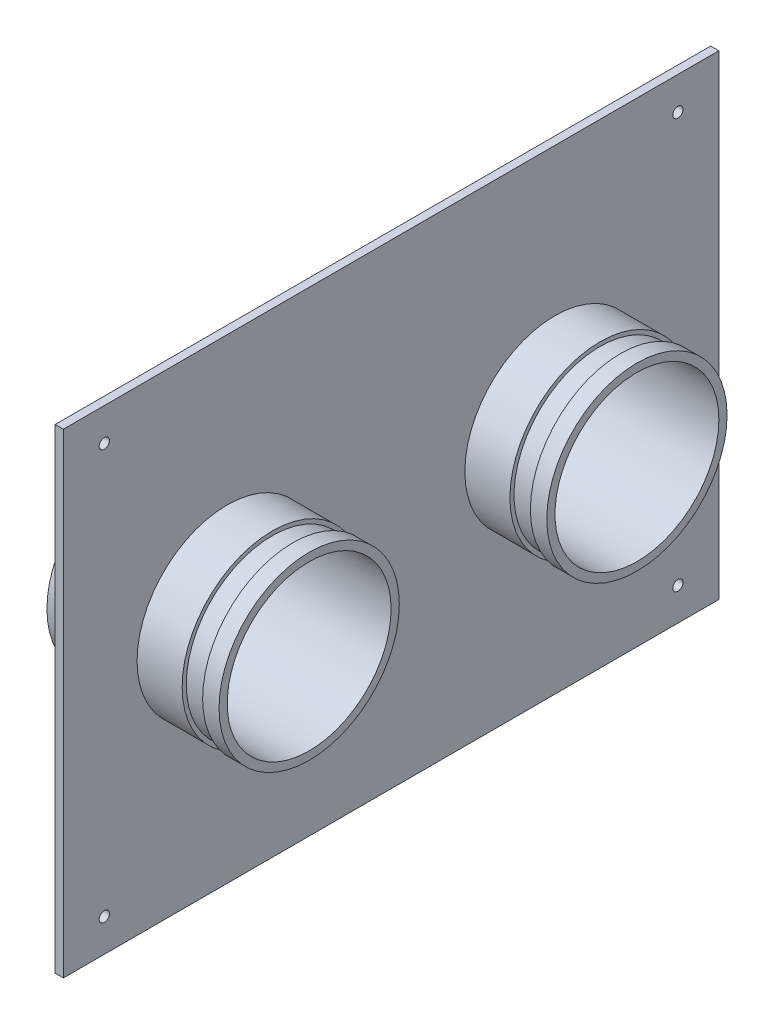
from build123d import *

# Parameters (mm, degrees)
SKETCH1_W                = 203.2
SKETCH1_H                = 152.4
SKETCH1_R                = 25.4
BOSS_EXTRUDE1_DEPTH      = 2.54
BOSS_EXTRUDE2_DEPTH      = 25.4
BOSS_EXTRUDE2_DEPTH_BACK = 27.94
SKETCH2_R                = 27.94
SKETCH2_R_2              = 25.4
CUT_EXTRUDE1_START       = -5.08
SKETCH3_R                = 27.94
SKETCH3_R_2              = 26.67
CUT_EXTRUDE1_DEPTH       = 6.35
SKETCH4_R                = 1.5875
CUT_EXTRUDE2_DEPTH       = 131.037085479
SKETCH5_W                = 203.2
SKETCH5_H                = 2.54
CUT_EXTRUDE3_DEPTH       = 131.037085479


with BuildPart() as part:
    # Sketch1 → Boss-Extrude1 (new body)
    with BuildSketch(Plane(origin=(0, 0, 0), x_dir=(0, 0, -1), z_dir=(1, 0, 0))):
        Rectangle(SKETCH1_W, SKETCH1_H)
        with Locations((50.8, 0)):
            Circle(SKETCH1_R, mode=Mode.SUBTRACT)
        with Locations((-50.8, 0)):
            Circle(SKETCH1_R, mode=Mode.SUBTRACT)
    extrude(amount=BOSS_EXTRUDE1_DEPTH)

    # Sketch2 → Boss-Extrude2 (add, two sides: drawn at the far end of the back side and taken through both)
    # profile 1 of 2: a face of its own
    with BuildSketch(Plane(origin=(2.54, 0, 0), x_dir=(0, 0, -1), z_dir=(1, 0, 0)).offset(-BOSS_EXTRUDE2_DEPTH_BACK)):
        with Locations((-50.8, 0)):
            Circle(SKETCH2_R)
        with Locations((-50.8, 0)):
            Circle(SKETCH2_R_2, mode=Mode.SUBTRACT)
    # profile 2 of 2: a face of its own
    with BuildSketch(Plane(origin=(2.54, 0, 0), x_dir=(0, 0, -1), z_dir=(1, 0, 0)).offset(-BOSS_EXTRUDE2_DEPTH_BACK)):
        with Locations((50.8, 0)):
            Circle(SKETCH2_R)
        with Locations((50.8, 0)):
            Circle(SKETCH2_R_2, mode=Mode.SUBTRACT)
    extrude(amount=BOSS_EXTRUDE2_DEPTH + BOSS_EXTRUDE2_DEPTH_BACK)

    # Sketch3 → Cut-Extrude1 (cut)
    with BuildSketch(Plane(origin=(27.94, 0, 0), x_dir=(0, 0, -1), z_dir=(1, 0, 0)).offset(CUT_EXTRUDE1_START)):
        with Locations((50.8, 0)):
            Circle(SKETCH3_R)
        with Locations((50.8, 0)):
            Circle(SKETCH3_R_2, mode=Mode.SUBTRACT)
    cut_extrude1 = extrude(amount=-CUT_EXTRUDE1_DEPTH, mode=Mode.SUBTRACT)

    # Mirror1: Cut-Extrude1 across plane
    add(cut_extrude1.mirror(Plane.XY), mode=Mode.SUBTRACT)

    # Sketch4 → Cut-Extrude2 (cut, through all)
    with BuildSketch(Plane(origin=(2.54, 0, 0), x_dir=(0, 0, -1), z_dir=(1, 0, 0))):
        with Locations((-88.9, 63.5)):
            Circle(SKETCH4_R)
        with Locations((88.9, 63.5)):
            Circle(SKETCH4_R)
        with Locations((88.9, -63.5)):
            Circle(SKETCH4_R)
        with Locations((-88.9, -63.5)):
            Circle(SKETCH4_R)
    extrude(amount=-CUT_EXTRUDE2_DEPTH, mode=Mode.SUBTRACT)

    # Sketch5 → Cut-Extrude3 (cut, through all)
    with BuildSketch(Plane(origin=(2.54, 0, 0), x_dir=(0, 0, -1), z_dir=(1, 0, 0))):
        with Locations((0, -74.93)):
            Rectangle(SKETCH5_W, SKETCH5_H)
        with Locations((0, 74.93)):
            Rectangle(SKETCH5_W, SKETCH5_H)
    extrude(amount=-CUT_EXTRUDE3_DEPTH, mode=Mode.SUBTRACT)


solid = part.part
